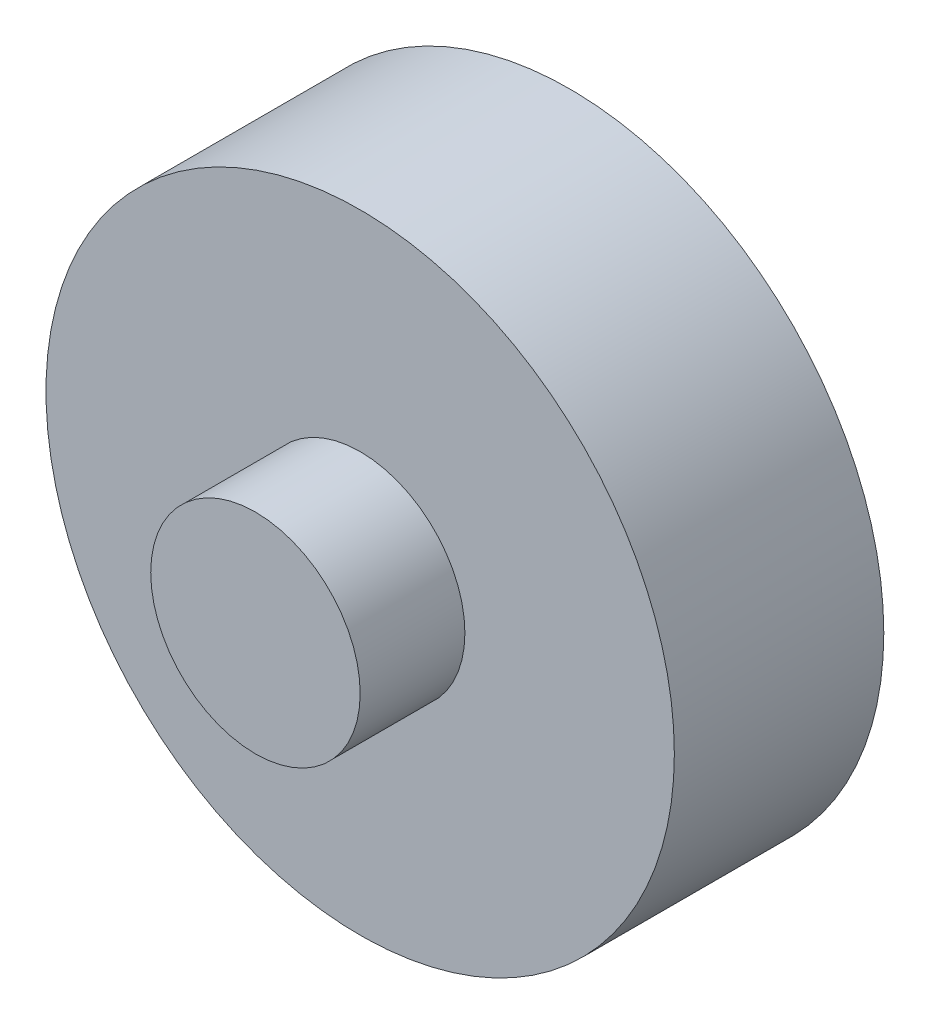
from build123d import *

# Parameters (mm, degrees)
SKETCH2_R                = 7.5
BOSS_EXTRUDE1_DEPTH      = 2.5
BOSS_EXTRUDE2_DEPTH      = 5
BOSS_EXTRUDE2_DEPTH_BACK = 5
SKETCH3_R                = 2.5


with BuildPart() as part:
    # Sketch2 → Boss-Extrude1 (new, symmetric)
    with BuildSketch(Plane.XY):
        Circle(SKETCH2_R)
    extrude(amount=BOSS_EXTRUDE1_DEPTH, both=True)

    # Sketch3 → Boss-Extrude2 (add, two sides: drawn at the far end of the back side and taken through both)
    with BuildSketch(Plane.XY.offset(-BOSS_EXTRUDE2_DEPTH_BACK)):
        Circle(SKETCH3_R)
    extrude(amount=BOSS_EXTRUDE2_DEPTH + BOSS_EXTRUDE2_DEPTH_BACK)


solid = part.part
